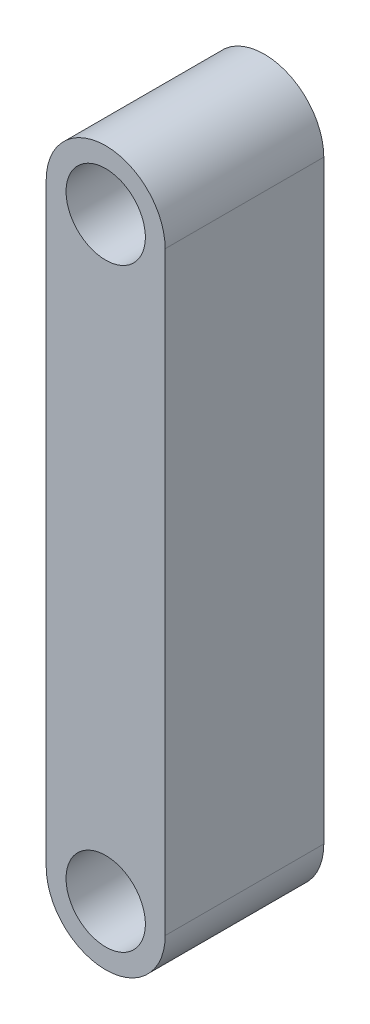
from build123d import *

# Parameters (mm, degrees)
BOSS_EXTRUDE1_DEPTH     = 8
F_4_0_MM_DOWEL_HOLES1_D = 4


with BuildPart() as part:
    # Sketch1 → Boss-Extrude1 (new body)
    with BuildSketch(Plane.XY):
        with BuildLine():
            Line((-3, 15), (-3, -15))
            ThreePointArc((-3, -15), (0, -18), (3, -15))
            Line((3, -15), (3, 15))
            ThreePointArc((3, 15), (0, 18), (-3, 15))
        make_face()
    extrude(amount=BOSS_EXTRUDE1_DEPTH)

    # Ø4.0 mm Dowel Holes1 (through all)
    with Locations(Plane(origin=(0, 0, 0), x_dir=(-1, 0, 0), z_dir=(0, 0, -1))):
        with Locations((0, 15)):
            f_4_0_mm_dowel_holes1 = Hole(F_4_0_MM_DOWEL_HOLES1_D / 2)

    # Mirror1: Ø4.0 mm Dowel Holes1 across plane
    add(f_4_0_mm_dowel_holes1.mirror(Plane.ZX), mode=Mode.SUBTRACT)


solid = part.part
